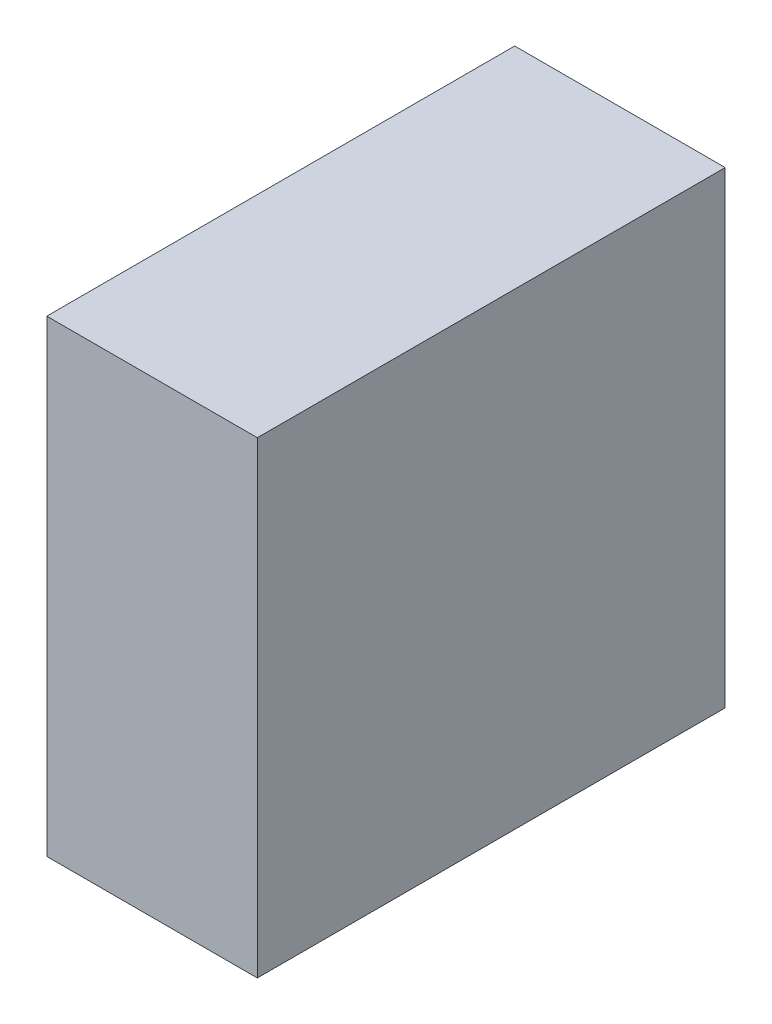
from build123d import *

# Parameters (mm, degrees)
PACK_PANO_MOTOR_SURUCU_2_1_START = -148
SKETCH1_W                        = 45
SKETCH1_H                        = 100
PACK_PANO_MOTOR_SURUCU_2_1_DEPTH = 100


with BuildPart() as part:
    # Sketch1 → PACK_pano_motor_surucu_2_1 (new body)
    with BuildSketch(Plane.XY.offset(PACK_PANO_MOTOR_SURUCU_2_1_START)):
        with Locations((472.5, 230)):
            Rectangle(SKETCH1_W, SKETCH1_H)
    extrude(amount=-PACK_PANO_MOTOR_SURUCU_2_1_DEPTH)


solid = part.part
